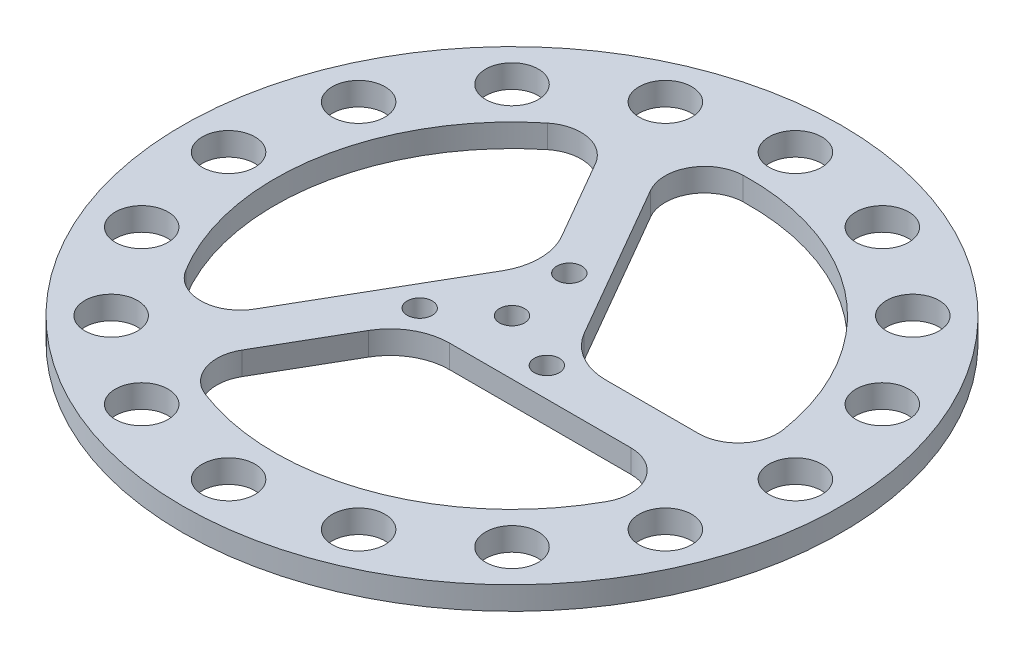
from build123d import *

# Parameters (mm, degrees)
SKETCH1_R           = 50
SKETCH1_R_2         = 1.9
BOSS_EXTRUDE1_DEPTH = 3.5
SKETCH2_R           = 4
CUT_EXTRUDE1_DEPTH  = 3.5
CIRPATTERN1_COUNT   = 16
CUT_EXTRUDE5_DEPTH  = 10
CIRPATTERN3_COUNT   = 3
SKETCH4_R           = 1.9
CUT_EXTRUDE6_DEPTH  = 3.5


with BuildPart() as part:
    # Sketch1 → Boss-Extrude1 (new body)
    with BuildSketch(Plane(origin=(0, 0, 0), x_dir=(1, 0, 0), z_dir=(0, 1, 0))):
        with Locations(Location((0, 0, 0), (0, 0, 270))):
            Circle(SKETCH1_R)
        with Locations(Location((0, 0, 0), (0, 0, 270))):
            Circle(SKETCH1_R_2, mode=Mode.SUBTRACT)
    extrude(amount=BOSS_EXTRUDE1_DEPTH)

    # Sketch2 → Cut-Extrude1 (cut)
    with BuildSketch(Plane(origin=(0, 3.5, 0), x_dir=(1, 0, 0), z_dir=(0, 1, 0))):
        with Locations(Location((0, 43, 0), (0, 0, 270))):
            Circle(SKETCH2_R)
    cut_extrude1 = extrude(amount=-CUT_EXTRUDE1_DEPTH, mode=Mode.SUBTRACT)

    # CirPattern1: Cut-Extrude1 ×16 about axis
    cirpattern1_axis = Axis((0, 0, 0), (0, 1, 0))
    for i in range(1, CIRPATTERN1_COUNT):
        add(cut_extrude1.rotate(cirpattern1_axis, i * 360 / CIRPATTERN1_COUNT), mode=Mode.SUBTRACT)

    # Sketch3 → Cut-Extrude5 (cut)
    with BuildSketch(Plane(origin=(0, 3.5, 0), x_dir=(1, 0, 0), z_dir=(0, 1, 0))):
        with BuildLine():
            ThreePointArc((7.794228634, 3.166666667), (11.088457268, -0.127561967), (15.588457268, -1.333333333))
            Line((15.588457268, -1.333333333), (29.634814361, -1.333333333))
            ThreePointArc((29.634814361, -1.333333333), (34.195516062, 0.767948929), (35.561777233, 5.6))
            ThreePointArc((35.561777233, 5.6), (23.0418607, 27.659946773), (-0.917016216, 35.988318678))
            ThreePointArc((-0.917016216, 35.988318678), (-5.998123181, 32.92383688), (-5.960332603, 26.990265565))
            Line((-5.960332603, 26.990265565), (0, 16.666666667))
            Line((0, 16.666666667), (7.794228634, 3.166666667))
        make_face()
    cut_extrude5 = extrude(amount=-CUT_EXTRUDE5_DEPTH, mode=Mode.SUBTRACT)

    # CirPattern3: Cut-Extrude5 ×3 about axis
    cirpattern3_axis = Axis((0, 0, 0), (0, 1, 0))
    for i in range(1, CIRPATTERN3_COUNT):
        add(cut_extrude5.rotate(cirpattern3_axis, i * 360 / CIRPATTERN3_COUNT), mode=Mode.SUBTRACT)

    # Sketch4 → Cut-Extrude6 (cut)
    with BuildSketch(Plane(origin=(0, 0, 0), x_dir=(1, 0, 0), z_dir=(0, 1, 0))):
        with Locations(Location((-1.230688491, 9.92398135, 0), (0, 0, 90))):
            Circle(SKETCH4_R)
        with Locations(Location((9.18308139, -3.899170456, 0), (0, 0, 90))):
            Circle(SKETCH4_R)
        with Locations(Location((-7.995004175, -6.006183819, 0), (0, 0, 90))):
            Circle(SKETCH4_R)
    extrude(amount=CUT_EXTRUDE6_DEPTH, mode=Mode.SUBTRACT)


solid = part.part
